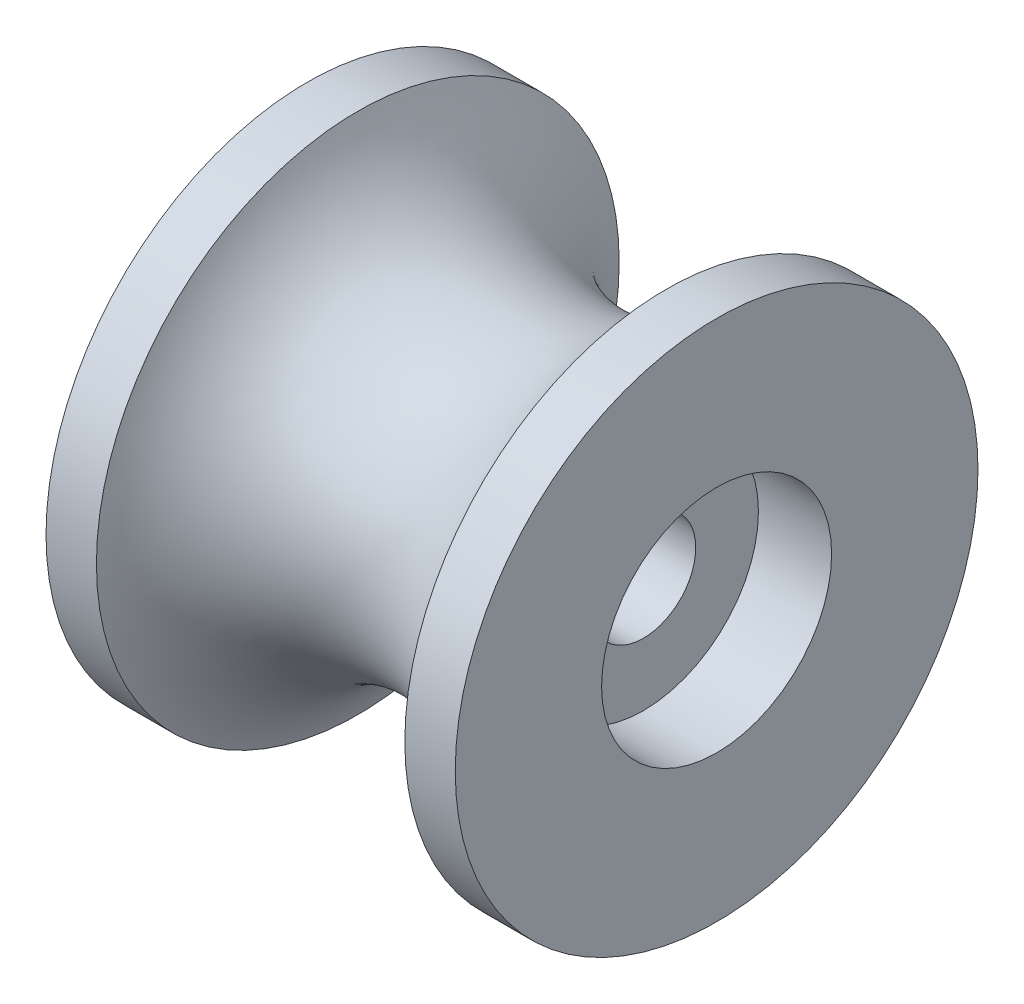
from build123d import *

# Parameters (mm, degrees)
BOSS_EXTRUDE1_DEPTH      = 19.57
BOSS_EXTRUDE1_DEPTH_BACK = 19.57
SKETCH1_R                = 25
SKETCH1_R_2              = 5
CUT_EXTRUDE1_START       = 19.57
SKETCH2_R                = 11
CUT_EXTRUDE1_DEPTH       = 7
CUT_EXTRUDE2_START       = -12.57
SKETCH3_R                = 11
CUT_EXTRUDE2_DEPTH       = 7
SKETCH4_R                = 15.875


with BuildPart() as part:
    # Sketch1 → Boss-Extrude1 (new, two sides: drawn at the far end of the back side and taken through both)
    with BuildSketch(Plane(origin=(0, 0, 0), x_dir=(0, 0, -1), z_dir=(1, 0, 0)).offset(-BOSS_EXTRUDE1_DEPTH_BACK)):
        Circle(SKETCH1_R)
        Circle(SKETCH1_R_2, mode=Mode.SUBTRACT)
    extrude(amount=BOSS_EXTRUDE1_DEPTH + BOSS_EXTRUDE1_DEPTH_BACK)

    # Sketch2 → Cut-Extrude1 (cut)
    with BuildSketch(Plane(origin=(0, 0, 0), x_dir=(0, 0, -1), z_dir=(1, 0, 0)).offset(CUT_EXTRUDE1_START)):
        Circle(SKETCH2_R)
    extrude(amount=-CUT_EXTRUDE1_DEPTH, mode=Mode.SUBTRACT)

    # Sketch3 → Cut-Extrude2 (cut)
    with BuildSketch(Plane(origin=(0, 0, 0), x_dir=(0, 0, -1), z_dir=(1, 0, 0)).offset(CUT_EXTRUDE2_START)):
        Circle(SKETCH3_R)
    extrude(amount=-CUT_EXTRUDE2_DEPTH, mode=Mode.SUBTRACT)

    # Sketch4 → Cut-Revolve1 (revolve, cut)
    with BuildSketch(Plane.XY, mode=Mode.PRIVATE) as cut_revolve1_sk:
        with Locations((0, 30.875)):
            Circle(SKETCH4_R)
    revolve(cut_revolve1_sk.sketch.rotate(Axis((0, 0, 0), (1, 0, 0)), 270), axis=Axis((0, 0, 0), (1, 0, 0)), mode=Mode.SUBTRACT)


solid = part.part
